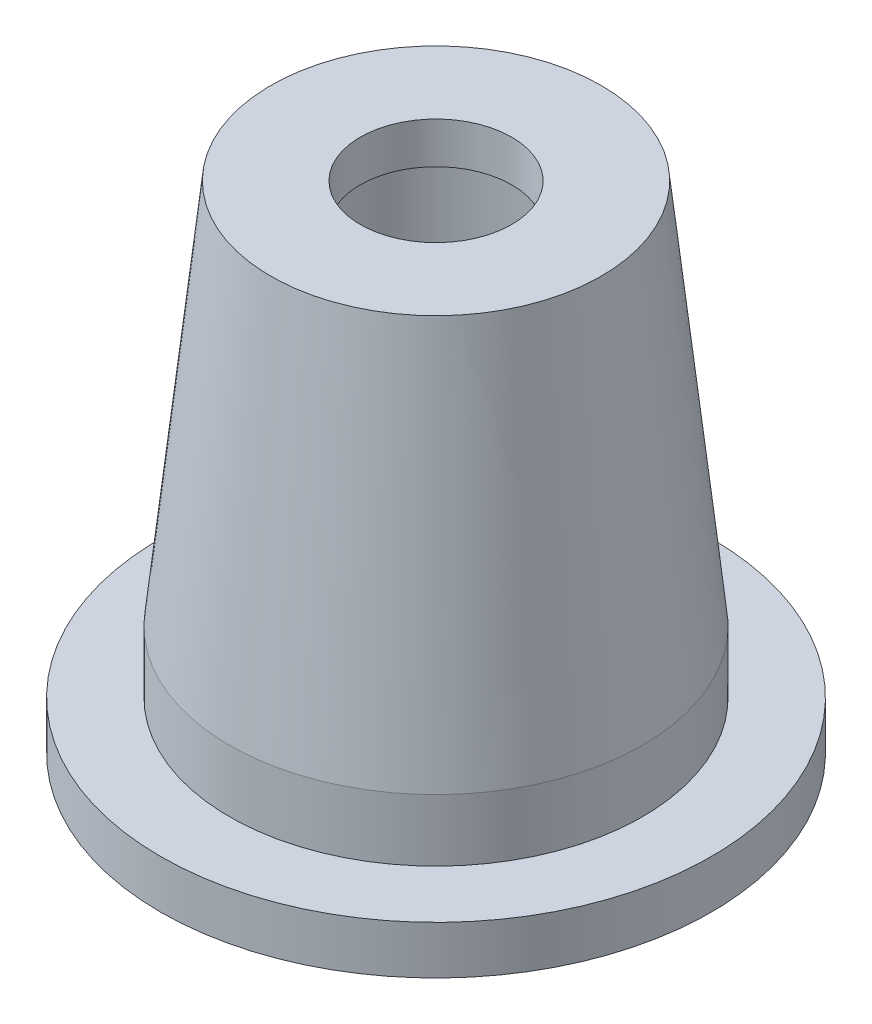
from build123d import *

# Parameters (mm, degrees)
CHAMFER_1_SIZE = 3


with BuildPart() as part:
    # Эскиз1 → Повернуть1 (revolve)
    with BuildSketch(Plane.XY, mode=Mode.PRIVATE) as revolve_1_sk:
        Polygon((9, 0), (20, 0), (20, 3.5), (15, 3.5), (15, 8), (12, 36), (5.5, 36), (5.5, 33), (9, 33), align=None)
    revolve(revolve_1_sk.sketch.rotate(Axis((0, 0, 0), (0, 1, 0)), 90), axis=Axis((0, 0, 0), (0, 1, 0)))

    # Эскиз2 → Вырез-Повернуть1 (revolve, cut)
    with BuildSketch(Plane.XY, mode=Mode.PRIVATE) as cut_revolve_1_sk:
        with BuildLine():
            Line((13.5, -3.5), (13.5, -0.5))
            ThreePointArc((13.5, -0.5), (15.5, 1.5), (17.5, -0.5))
            Line((17.5, -0.5), (17.5, -3.5))
            ThreePointArc((17.5, -3.5), (15.5, -5.5), (13.5, -3.5))
        make_face()
    revolve(cut_revolve_1_sk.sketch.rotate(Axis((0, 0, 0), (0, 1, 0)), 90), axis=Axis((0, 0, 0), (0, 1, 0)), mode=Mode.SUBTRACT)

    # Фаска1
    chamfer_1_edges = [part.edges().sort_by_distance(p)[0] for p in [
        (0, 0, 9),
    ]]
    chamfer(chamfer_1_edges, length=CHAMFER_1_SIZE)


solid = part.part
